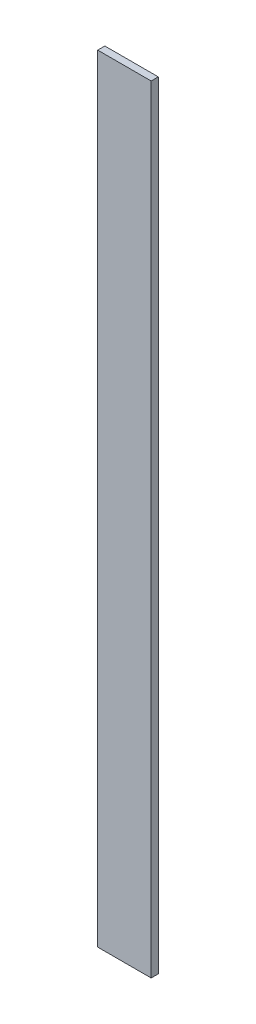
from build123d import *

# Parameters (mm, degrees)
SKETCH1_W           = 15
SKETCH1_H           = 218
BOSS_EXTRUDE1_DEPTH = 2


with BuildPart() as part:
    # Sketch1 → Boss-Extrude1 (new body)
    with BuildSketch(Plane.XY):
        Rectangle(SKETCH1_W, SKETCH1_H)
    extrude(amount=BOSS_EXTRUDE1_DEPTH)


solid = part.part
